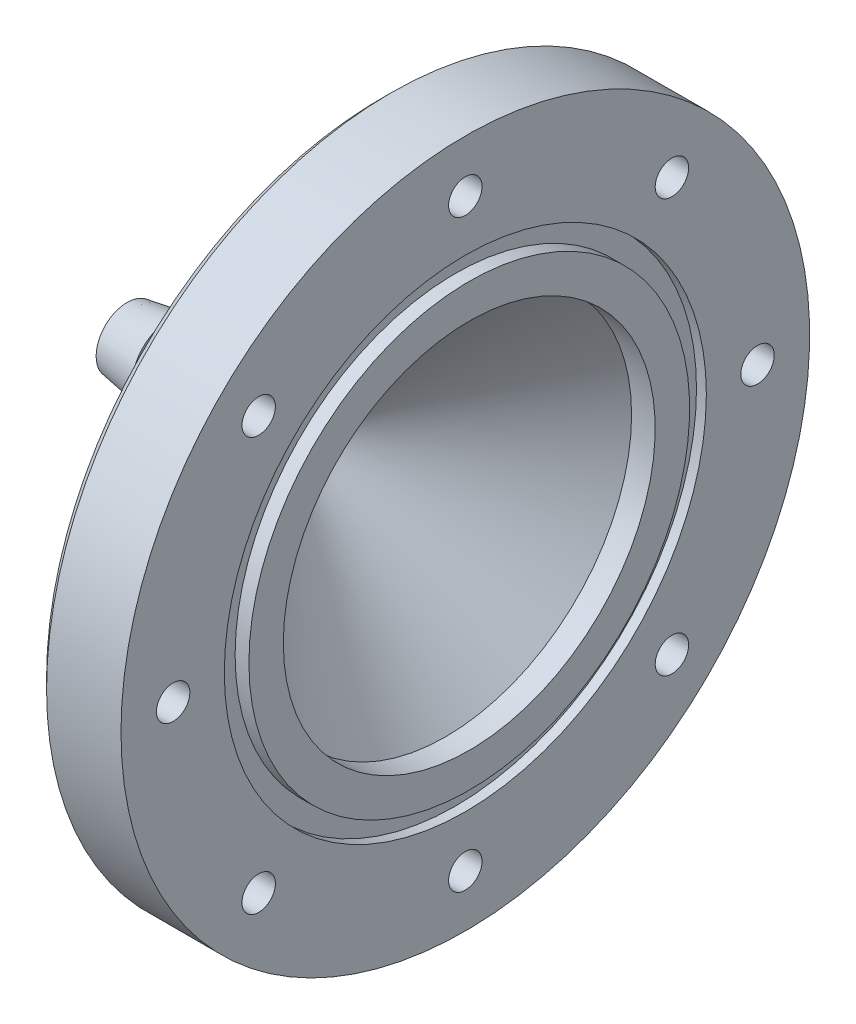
from build123d import *

# Parameters (mm, degrees)
SKETCH1_W                                           = 1.4
SKETCH1_H                                           = 3.5
CBORE_FOR_M3_HEX_SOCKET_HEAD_CAP_SCREW2_D           = 3.4
CBORE_FOR_M3_HEX_SOCKET_HEAD_CAP_SCREW2_DEPTH       = 8.566
CBORE_FOR_M3_HEX_SOCKET_HEAD_CAP_SCREW2_CBORE_D     = 6.5
CBORE_FOR_M3_HEX_SOCKET_HEAD_CAP_SCREW2_CBORE_DEPTH = 3.4
CBORE_FOR_M3_HEX_SOCKET_HEAD_CAP_SCREW2_TIP         = 1.021463052
CHAMFER1_SIZE                                       = 1


with BuildPart() as part:
    # Sketch1 → Revolve17 (revolve)
    with BuildSketch(Plane.XY, mode=Mode.PRIVATE) as revolve17_sk:
        Polygon((-13.572880732, 3.15), (-13.572880732, 3.85), (-17.906214066, 3.15), (-17.906214066, 1.9), (0, 1.9), (14.469928658, 18.9), (15.469928658, 18.9), (15.469928658, 22.4), (15.469928658, 24.5), (16.469928658, 24.5), (16.469928658, 35), (7.903928658, 35), (7.903928658, 18.9), (-4.906214066, 3.85), (-9.239547399, 3.15), (-9.239547399, 3.85), align=None)
        with Locations((16.169928658, 20.65)):
            Rectangle(SKETCH1_W, SKETCH1_H)
    revolve(revolve17_sk.sketch.rotate(Axis((-801.920554309, 0, 0), (1, 0, 0)), 90), axis=Axis((-801.920554309, 0, 0), (1, 0, 0)))

    # CBORE for M3 Hex Socket Head Cap Screw2
    with Locations(Plane.ZY.offset(-7.903928658)):
        with Locations((-21.001071401, -21.154915542), (0, 29.7), (29.7, 0), (-29.7, 0), (0, -29.7), (-21.001071401, 20.847227261), (21.001071401, 20.847227261), (21.001071401, -21.154915542)):
            CounterBoreHole(CBORE_FOR_M3_HEX_SOCKET_HEAD_CAP_SCREW2_D / 2, CBORE_FOR_M3_HEX_SOCKET_HEAD_CAP_SCREW2_CBORE_D / 2, CBORE_FOR_M3_HEX_SOCKET_HEAD_CAP_SCREW2_CBORE_DEPTH, depth=CBORE_FOR_M3_HEX_SOCKET_HEAD_CAP_SCREW2_DEPTH)
            with Locations((0, 0, -(CBORE_FOR_M3_HEX_SOCKET_HEAD_CAP_SCREW2_DEPTH + CBORE_FOR_M3_HEX_SOCKET_HEAD_CAP_SCREW2_TIP / 2))):  # 118° drill point
                Cone(0, CBORE_FOR_M3_HEX_SOCKET_HEAD_CAP_SCREW2_D / 2, CBORE_FOR_M3_HEX_SOCKET_HEAD_CAP_SCREW2_TIP, mode=Mode.SUBTRACT)

    # Chamfer1
    chamfer1_edges = [part.edges().sort_by_distance(p)[0] for p in [
        (7.903928658, 0, -35),
    ]]
    chamfer(chamfer1_edges, length=CHAMFER1_SIZE)


solid = part.part
